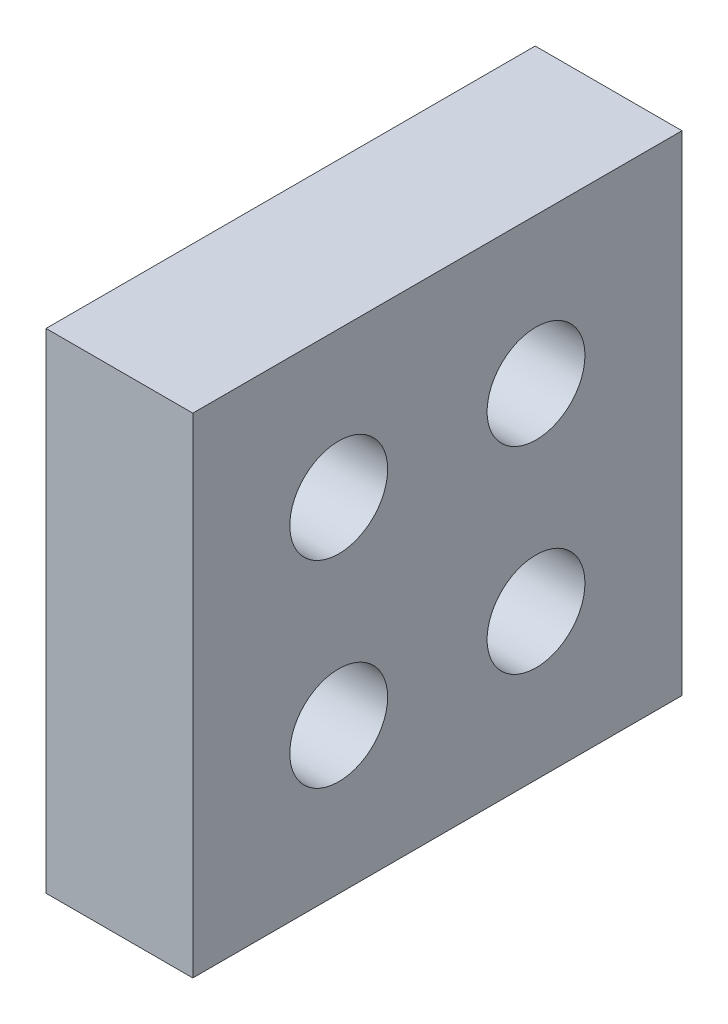
from build123d import *

# Parameters (mm, degrees)
SKETCH1_W           = 30
SKETCH1_H           = 30
SKETCH1_R           = 3
BOSS_EXTRUDE1_DEPTH = 9


with BuildPart() as part:
    # Sketch1 → Boss-Extrude1 (new body)
    with BuildSketch(Plane.YZ):
        Rectangle(SKETCH1_W, SKETCH1_H)
        with Locations(Location((6.050252532, 6.050252532, 0), (0, 0, 270))):
            Circle(SKETCH1_R, mode=Mode.SUBTRACT)
        with Locations(Location((-6.050252532, 6.050252532, 0), (0, 0, 270))):
            Circle(SKETCH1_R, mode=Mode.SUBTRACT)
        with Locations(Location((-6.050252532, -6.050252532, 0), (0, 0, 270))):
            Circle(SKETCH1_R, mode=Mode.SUBTRACT)
        with Locations(Location((6.050252532, -6.050252532, 0), (0, 0, 270))):
            Circle(SKETCH1_R, mode=Mode.SUBTRACT)
    extrude(amount=BOSS_EXTRUDE1_DEPTH)


solid = part.part
